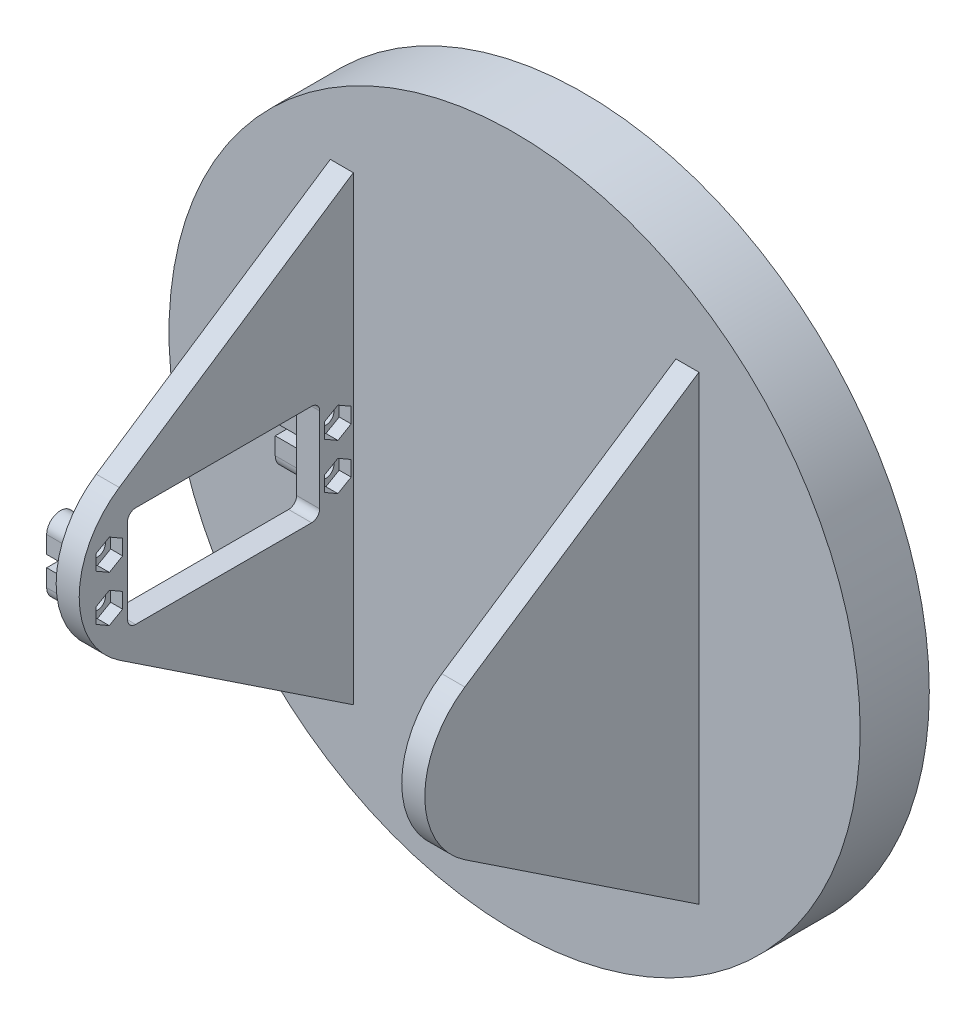
from build123d import *

# Parameters (mm, degrees)
SKETCH1_R           = 75
BASE_PLATE_DEPTH    = 15
SKETCH2_R           = 4.5
DRIVE_HOLES_DEPTH   = 10
CHAMFER1_SIZE       = 1
BASE_START          = 40
BASE_FIN_DEPTH      = 5
BASE_START_2        = 70
BASE_FIN_2_DEPTH    = 5
CUT_EXTRUDE1_REACH  = 158.203
CUT_EXTRUDE2_REACH  = 158.203
SKETCH7_R           = 1.75
BOSS_EXTRUDE1_DEPTH = 5.6
CUT_EXTRUDE3_START  = -5.6
SKETCH9_R           = 1.75
CUT_EXTRUDE3_DEPTH  = 5.6
SKETCH10_W          = 4.6
SKETCH10_H          = 2.5
SKETCH10_W_2        = 6
CUT_EXTRUDE4_DEPTH  = 5.6
CUT_EXTRUDE5_DEPTH  = 2.6


with BuildPart() as part:
    # Sketch1 → Base Plate (new body)
    with BuildSketch(Plane.XY):
        Circle(SKETCH1_R)
    extrude(amount=BASE_PLATE_DEPTH)

    # Sketch2 → Drive Holes (cut)
    with BuildSketch(Plane(origin=(0, 0, 0), x_dir=(-1, 0, 0), z_dir=(0, 0, -1))):
        with Locations((0, -25)):
            Circle(SKETCH2_R)
        with Locations((-23.776412907, -7.725424859)):
            Circle(SKETCH2_R)
        with Locations((-14.694631307, 20.225424859)):
            Circle(SKETCH2_R)
        with Locations((14.694631307, 20.225424859)):
            Circle(SKETCH2_R)
        with Locations((23.776412907, -7.725424859)):
            Circle(SKETCH2_R)
    extrude(amount=-DRIVE_HOLES_DEPTH, mode=Mode.SUBTRACT)

    # Chamfer1
    chamfer1_edges = [part.edges().sort_by_distance(p)[0] for p in [
        (28.276412907, -7.725424859, 0),
        (19.194631307, 20.225424859, 0),
        (-10.194631307, 20.225424859, 0),
        (-19.276412907, -7.725424859, 0),
        (4.5, -25, 0),
    ]]
    chamfer(chamfer1_edges, length=CHAMFER1_SIZE)

    # Sketch4 → Base Fin (add)
    with BuildSketch(Plane(origin=(0, 0, 0), x_dir=(0, 0, -1), z_dir=(1, 0, 0)).offset(BASE_START)):
        with BuildLine():
            Line((-15, 50), (-65.791986374, 16.233382914))
            ThreePointArc((-65.791986374, 16.233382914), (-74.493324261, 0), (-65.791986374, -16.233382914))
            Line((-65.791986374, -16.233382914), (-15, -50))
            Line((-15, -50), (-15, 50))
        make_face()
    extrude(amount=-BASE_FIN_DEPTH)

    # Sketch5 → Base Fin 2 (add)
    with BuildSketch(Plane.ZY.offset(-35).offset(BASE_START_2)):
        with BuildLine():
            Line((15, 50), (15, -50))
            Line((15, -50), (65.791986374, -16.233382914))
            ThreePointArc((65.791986374, -16.233382914), (74.493324261, 0), (65.791986374, 16.233382914))
            Line((65.791986374, 16.233382914), (15, 50))
        make_face()
    extrude(amount=BASE_FIN_2_DEPTH)

    # Sketch6 → Cut-Extrude1 (cut, up to next)
    with BuildSketch(Plane.ZY.offset(40), mode=Mode.PRIVATE) as cut_extrude1_sk1:
        with BuildLine():
            Line((64, 8.875345998), (64, -9.524654002))
            ThreePointArc((64, -9.524654002), (63.487436867, -10.762090869), (62.25, -11.274654002))
            Line((62.25, -11.274654002), (24.05, -11.274654002))
            ThreePointArc((24.05, -11.274654002), (22.812563133, -10.762090869), (22.3, -9.524654002))
            Line((22.3, -9.524654002), (22.3, 8.875345998))
            ThreePointArc((22.3, 8.875345998), (22.812563133, 10.112782865), (24.05, 10.625345998))
            Line((24.05, 10.625345998), (62.25, 10.625345998))
            ThreePointArc((62.25, 10.625345998), (63.487436867, 10.112782865), (64, 8.875345998))
        make_face()
    cut_extrude1_tool1 = extrude(cut_extrude1_sk1.sketch, amount=-CUT_EXTRUDE1_REACH, mode=Mode.PRIVATE) & part.part
    add(cut_extrude1_tool1.solids().sort_by_distance((-40, -0.324654, 43.15))[0], mode=Mode.SUBTRACT)

    # Sketch7 → Cut-Extrude2 (cut, up to next)
    with BuildSketch(Plane.ZY.offset(40), mode=Mode.PRIVATE) as cut_extrude2_sk1:
        with Locations((18.35, 4.675345998)):
            Circle(SKETCH7_R)
    cut_extrude2_tool1 = extrude(cut_extrude2_sk1.sketch, amount=-CUT_EXTRUDE2_REACH, mode=Mode.PRIVATE) & part.part
    # Sketch7 → Cut-Extrude2 (cut, up to next)
    with BuildSketch(Plane.ZY.offset(40), mode=Mode.PRIVATE) as cut_extrude2_sk2:
        with Locations((18.35, -5.324654002)):
            Circle(SKETCH7_R)
    cut_extrude2_tool2 = extrude(cut_extrude2_sk2.sketch, amount=-CUT_EXTRUDE2_REACH, mode=Mode.PRIVATE) & part.part
    # Sketch7 → Cut-Extrude2 (cut, up to next)
    with BuildSketch(Plane.ZY.offset(40), mode=Mode.PRIVATE) as cut_extrude2_sk3:
        with Locations((67.95, -5.324654002)):
            Circle(SKETCH7_R)
    cut_extrude2_tool3 = extrude(cut_extrude2_sk3.sketch, amount=-CUT_EXTRUDE2_REACH, mode=Mode.PRIVATE) & part.part
    # Sketch7 → Cut-Extrude2 (cut, up to next)
    with BuildSketch(Plane.ZY.offset(40), mode=Mode.PRIVATE) as cut_extrude2_sk4:
        with Locations((67.95, 4.675345998)):
            Circle(SKETCH7_R)
    cut_extrude2_tool4 = extrude(cut_extrude2_sk4.sketch, amount=-CUT_EXTRUDE2_REACH, mode=Mode.PRIVATE) & part.part
    add(cut_extrude2_tool1.solids().sort_by_distance((-40, 4.675346, 18.35))[0], mode=Mode.SUBTRACT)
    add(cut_extrude2_tool2.solids().sort_by_distance((-40, -5.324654, 18.35))[0], mode=Mode.SUBTRACT)
    add(cut_extrude2_tool3.solids().sort_by_distance((-40, -5.324654, 67.95))[0], mode=Mode.SUBTRACT)
    add(cut_extrude2_tool4.solids().sort_by_distance((-40, 4.675346, 67.95))[0], mode=Mode.SUBTRACT)

    # Sketch8 → Boss-Extrude1 (add)
    with BuildSketch(Plane.ZY.offset(40)):
        with BuildLine():
            Line((70.95, 4.675345998), (70.95, -5.324654002))
            ThreePointArc((70.95, -5.324654002), (67.95, -8.324654002), (64.95, -5.324654002))
            Line((64.95, -5.324654002), (64.95, 4.675345998))
            ThreePointArc((64.95, 4.675345998), (67.95, 7.675345998), (70.95, 4.675345998))
        make_face()
        with BuildLine():
            Line((15, 7.675345998), (15, 0))
            Line((15, 0), (15, -8.324654002))
            Line((15, -8.324654002), (18.35, -8.324654002))
            ThreePointArc((18.35, -8.324654002), (20.471320344, -7.445974346), (21.35, -5.324654002))
            Line((21.35, -5.324654002), (21.35, 4.675345998))
            ThreePointArc((21.35, 4.675345998), (20.471320344, 6.796666341), (18.35, 7.675345998))
            Line((18.35, 7.675345998), (15, 7.675345998))
        make_face()
    extrude(amount=BOSS_EXTRUDE1_DEPTH)

    # Sketch9 → Cut-Extrude3 (cut)
    with BuildSketch(Plane(origin=(-40, 0, 0), x_dir=(0, 0, -1), z_dir=(1, 0, 0)).offset(CUT_EXTRUDE3_START)):
        with Locations(Location((-67.95, -5.324654002, 0), (0, 0, 180))):
            Circle(SKETCH9_R)
        with Locations(Location((-67.95, 4.675345998, 0), (0, 0, 180))):
            Circle(SKETCH9_R)
        with Locations(Location((-18.35, -5.324654002, 0), (0, 0, 180))):
            Circle(SKETCH9_R)
        with Locations(Location((-18.35, 4.675345998, 0), (0, 0, 180))):
            Circle(SKETCH9_R)
    extrude(amount=CUT_EXTRUDE3_DEPTH, mode=Mode.SUBTRACT)

    # Sketch10 → Cut-Extrude4 (cut)
    with BuildSketch(Plane.ZY.offset(45.6)):
        with Locations((19.05, -0.324654002)):
            Rectangle(SKETCH10_W, SKETCH10_H)
        with Locations((67.95, -0.324654002)):
            Rectangle(SKETCH10_W_2, SKETCH10_H)
    extrude(amount=-CUT_EXTRUDE4_DEPTH, mode=Mode.SUBTRACT)

    # Sketch11 → Cut-Extrude5 (cut)
    with BuildSketch(Plane(origin=(-35, 0, 0), x_dir=(0, 0, -1), z_dir=(1, 0, 0))):
        Polygon((-67.94416086, -2.00489509), (-70.822075983, -3.659717702), (-70.827915123, -6.979476615), (-67.95583914, -8.644412915), (-65.077924017, -6.989590302), (-65.072084877, -3.66983139), align=None)
        Polygon((-67.95, 7.995110046), (-70.825, 6.335228022), (-70.825, 3.015463974), (-67.95, 1.35558195), (-65.075, 3.015463974), (-65.075, 6.335228022), align=None)
        Polygon((-18.353543237, -2.004891845), (-21.226769981, -3.667841457), (-21.223226744, -6.987603614), (-18.346456763, -8.644416159), (-15.473230019, -6.981466547), (-15.476773256, -3.66170439), align=None)
        Polygon((-18.355430794, 7.995105604), (-21.22771155, 6.330522595), (-21.222280756, 3.010762989), (-18.344569206, 1.355586392), (-15.47228845, 3.020169401), (-15.477719244, 6.339929006), align=None)
    extrude(amount=-CUT_EXTRUDE5_DEPTH, mode=Mode.SUBTRACT)


solid = part.part
